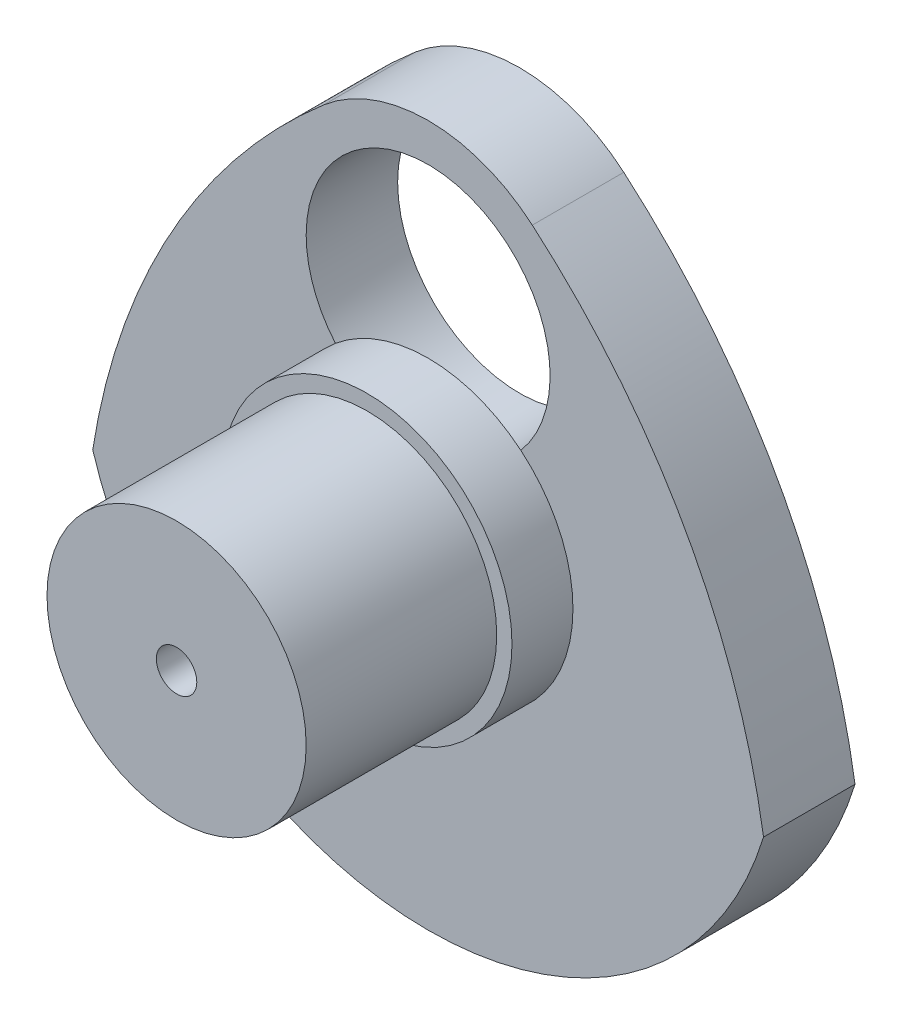
from build123d import *

# Parameters (mm, degrees)
SKETCH3_R           = 17
BOSS_EXTRUDE2_DEPTH = 25
SKETCH4_R           = 19
BOSS_EXTRUDE3_DEPTH = 8
BOSS_EXTRUDE4_DEPTH = 12
SKETCH9_R           = 16
CUT_EXTRUDE1_DEPTH  = 12
SKETCH10_R          = 2.65
CUT_EXTRUDE2_DEPTH  = 15


with BuildPart() as part:
    # Sketch3 → Boss-Extrude2 (new body)
    with BuildSketch(Plane.XY):
        Circle(SKETCH3_R)
    extrude(amount=BOSS_EXTRUDE2_DEPTH)

    # Sketch4 → Boss-Extrude3 (add)
    with BuildSketch(Plane.XY):
        Circle(SKETCH4_R)
    extrude(amount=-BOSS_EXTRUDE3_DEPTH)

    # Sketch5 → Boss-Extrude4 (add)
    with BuildSketch(Plane(origin=(0, 0, -8), x_dir=(-1, 0, 0), z_dir=(0, 0, -1))):
        with BuildLine():
            ThreePointArc((-44, -13.416407865), (0, -46), (44, -13.416407865))
            ThreePointArc((44, -13.416407865), (33.683444249, 16.469257624), (13.668094758, 40.943123461))
            ThreePointArc((13.668094758, 40.943123461), (0, 46), (-13.668094758, 40.943123461))
            ThreePointArc((-13.668094758, 40.943123461), (-33.683444249, 16.469257624), (-44, -13.416407865))
        make_face()
    extrude(amount=BOSS_EXTRUDE4_DEPTH)

    # Sketch9 → Cut-Extrude1 (cut)
    with BuildSketch(Plane(origin=(0, 0, -20), x_dir=(-1, 0, 0), z_dir=(0, 0, -1))):
        with Locations((0, 25)):
            Circle(SKETCH9_R)
    extrude(amount=-CUT_EXTRUDE1_DEPTH, mode=Mode.SUBTRACT)

    # Sketch10 → Cut-Extrude2 (cut)
    with BuildSketch(Plane.XY.offset(25)):
        Circle(SKETCH10_R)
    extrude(amount=-CUT_EXTRUDE2_DEPTH, mode=Mode.SUBTRACT)


solid = part.part
